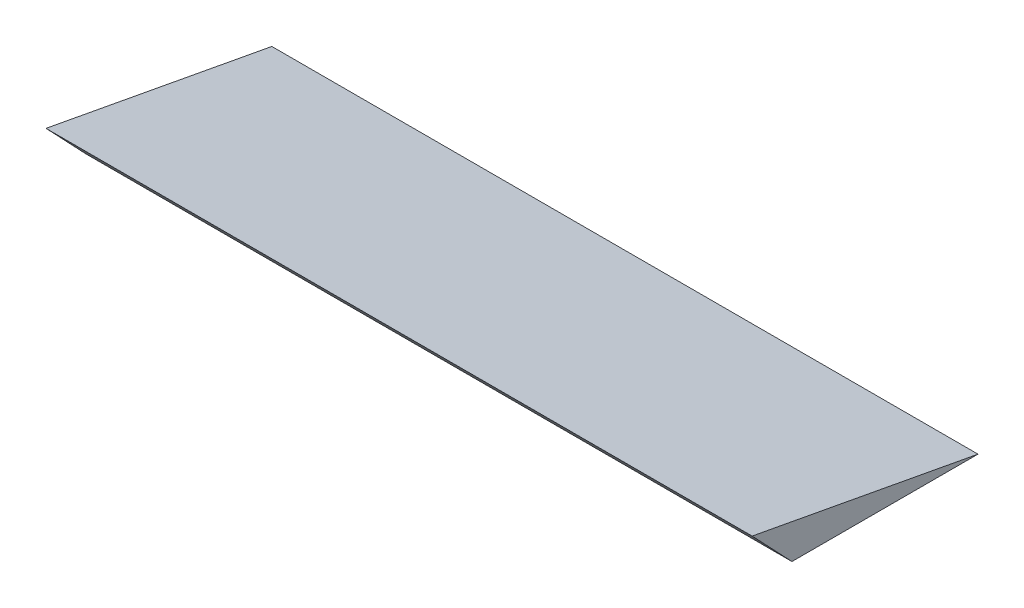
from build123d import *

# Parameters (mm, degrees)
BOSS_EXTRUDE1_DEPTH = 316.23


with BuildPart() as part:
    # Sketch1 → Boss-Extrude1 (new body)
    with BuildSketch(Plane(origin=(0, 0, 0), x_dir=(0, 0, -1), z_dir=(1, 0, 0))):
        Polygon((-45.055511651, 9.891260844), (-27.230209822, -8.909884831), (56.081790178, -8.909884831), align=None)
    extrude(amount=BOSS_EXTRUDE1_DEPTH)


solid = part.part
